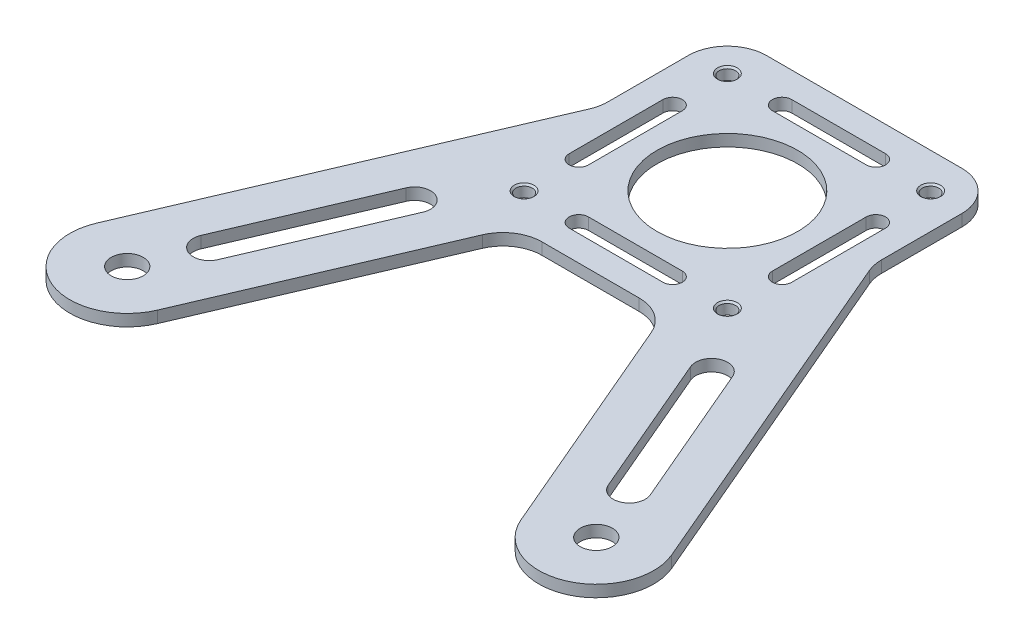
from build123d import *

# Parameters (mm, degrees)
EXTRUDE_1_DEPTH              = 3
HOLE_WIZARD_M5_1_D           = 4.2
HOLE_WIZARD_M5_1_CSINK_D     = 5.05
HOLE_WIZARD_M5_1_CSINK_ANGLE = 90
CUT_EXTRUDE_1_REACH          = 182.424
SKETCH_4_R                   = 4.1
FILLET_1_R                   = 10
CUT_EXTRUDE_2_REACH          = 182.424
SKETCH_5_R                   = 18
CUT_EXTRUDE_3_REACH          = 182.424


with BuildPart() as part:
    # 草图1 → 凸台-拉伸1 (new body)
    with BuildSketch(Plane(origin=(0, 0, 0), x_dir=(1, 0, 0), z_dir=(0, 1, 0))):
        with BuildLine():
            Line((0, 0), (70, 0))
            Line((70, 0), (70, -32.596529214))
            Line((70, -32.596529214), (83.512088558, -64.228012072))
            Line((83.512088558, -64.228012072), (108.512088558, -122.752426568))
            ThreePointArc((108.512088558, -122.752426568), (100.771987928, -142.036503054), (81.487911442, -134.296402424))
            Line((81.487911442, -134.296402424), (56.487911442, -75.771987928))
            Line((56.487911442, -75.771987928), (54.022278946, -70))
            Line((54.022278946, -70), (15.977721054, -70))
            Line((15.977721054, -70), (13.512088558, -75.771987928))
            Line((13.512088558, -75.771987928), (-11.487911442, -134.296402424))
            ThreePointArc((-11.487911442, -134.296402424), (-30.771987928, -142.036503054), (-38.512088558, -122.752426568))
            Line((-38.512088558, -122.752426568), (-13.512088558, -64.228012072))
            Line((-13.512088558, -64.228012072), (0, -32.596529214))
            Line((0, -32.596529214), (0, 0))
        make_face()
    extrude(amount=EXTRUDE_1_DEPTH)

    # M5 螺纹孔1 (through all)
    with Locations(Plane(origin=(0, 3, 0), x_dir=(1, 0, 0), z_dir=(0, 1, 0))):
        with Locations((9, -61), (61, -9), (9, -9), (61, -61)):
            CounterSinkHole(HOLE_WIZARD_M5_1_D / 2, HOLE_WIZARD_M5_1_CSINK_D / 2, counter_sink_angle=HOLE_WIZARD_M5_1_CSINK_ANGLE)

    # 草图4 → 切除-拉伸1 (cut, up to next)
    with BuildSketch(Plane(origin=(0, 3, 0), x_dir=(1, 0, 0), z_dir=(0, 1, 0)), mode=Mode.PRIVATE) as cut_extrude_1_sk1:
        with Locations(Location((-25, -128.524414496, 0), (0, 0, 270))):
            Circle(SKETCH_4_R)
    cut_extrude_1_tool1 = extrude(cut_extrude_1_sk1.sketch, amount=-CUT_EXTRUDE_1_REACH, mode=Mode.PRIVATE) & part.part
    # 草图4 → 切除-拉伸1 (cut, up to next)
    with BuildSketch(Plane(origin=(0, 3, 0), x_dir=(1, 0, 0), z_dir=(0, 1, 0)), mode=Mode.PRIVATE) as cut_extrude_1_sk2:
        with Locations(Location((95, -128.524414496, 0), (0, 0, 270))):
            Circle(SKETCH_4_R)
    cut_extrude_1_tool2 = extrude(cut_extrude_1_sk2.sketch, amount=-CUT_EXTRUDE_1_REACH, mode=Mode.PRIVATE) & part.part
    add(cut_extrude_1_tool1.solids().sort_by_distance((-25, 3, 128.524414))[0], mode=Mode.SUBTRACT)
    add(cut_extrude_1_tool2.solids().sort_by_distance((95, 3, 128.524414))[0], mode=Mode.SUBTRACT)

    # 圆角1
    fillet_1_edges = [part.edges().sort_by_distance(p)[0] for p in [
        (0, 1.5, 0),
        (70, 1.5, 0),
        (70, 1.5, 32.596529214),
        (54.022278946, 1.5, 70),
        (15.977721054, 1.5, 70),
        (0, 1.5, 32.596529214),
    ]]
    fillet(fillet_1_edges, radius=FILLET_1_R)

    # 草图5 → 切除-拉伸2 (cut, up to next)
    with BuildSketch(Plane(origin=(0, 3, 0), x_dir=(1, 0, 0), z_dir=(0, 1, 0)), mode=Mode.PRIVATE) as cut_extrude_2_sk1:
        with Locations(Location((35, -35, 0), (0, 0, 270))):
            Circle(SKETCH_5_R)
    cut_extrude_2_tool1 = extrude(cut_extrude_2_sk1.sketch, amount=-CUT_EXTRUDE_2_REACH, mode=Mode.PRIVATE) & part.part
    add(cut_extrude_2_tool1.solids().sort_by_distance((35, 3, 35))[0], mode=Mode.SUBTRACT)

    # 草图6 → 切除-拉伸3 (cut, up to next)
    with BuildSketch(Plane(origin=(0, 3, 0), x_dir=(1, 0, 0), z_dir=(0, 1, 0)), mode=Mode.PRIVATE) as cut_extrude_3_sk1:
        with BuildLine():
            Line((-22.485091694, -112.200038973), (-6.771815415, -75.415627212))
            ThreePointArc((-6.771815415, -75.415627212), (-1.390802391, -73.255835825), (0.768988996, -78.636848849))
            Line((0.768988996, -78.636848849), (-14.944287283, -115.42126061))
            ThreePointArc((-14.944287283, -115.42126061), (-20.325300307, -117.581051997), (-22.485091694, -112.200038973))
        make_face()
    cut_extrude_3_tool1 = extrude(cut_extrude_3_sk1.sketch, amount=-CUT_EXTRUDE_3_REACH, mode=Mode.PRIVATE) & part.part
    # 草图6 → 切除-拉伸3 (cut, up to next)
    with BuildSketch(Plane(origin=(0, 3, 0), x_dir=(1, 0, 0), z_dir=(0, 1, 0)), mode=Mode.PRIVATE) as cut_extrude_3_sk2:
        with BuildLine():
            Line((92.485091694, -112.200038973), (76.771815415, -75.415627212))
            ThreePointArc((76.771815415, -75.415627212), (71.390802391, -73.255835825), (69.231011004, -78.636848849))
            Line((69.231011004, -78.636848849), (84.944287283, -115.42126061))
            ThreePointArc((84.944287283, -115.42126061), (90.325300307, -117.581051997), (92.485091694, -112.200038973))
        make_face()
    cut_extrude_3_tool2 = extrude(cut_extrude_3_sk2.sketch, amount=-CUT_EXTRUDE_3_REACH, mode=Mode.PRIVATE) & part.part
    # 草图6 → 切除-拉伸3 (cut, up to next)
    with BuildSketch(Plane(origin=(0, 3, 0), x_dir=(1, 0, 0), z_dir=(0, 1, 0)), mode=Mode.PRIVATE) as cut_extrude_3_sk3:
        with BuildLine():
            Line((23, -6.522932736), (47, -6.522932736))
            ThreePointArc((47, -6.522932736), (49.477067264, -9), (47, -11.477067264))
            Line((47, -11.477067264), (23, -11.477067264))
            ThreePointArc((23, -11.477067264), (20.522932736, -9), (23, -6.522932736))
        make_face()
    cut_extrude_3_tool3 = extrude(cut_extrude_3_sk3.sketch, amount=-CUT_EXTRUDE_3_REACH, mode=Mode.PRIVATE) & part.part
    # 草图6 → 切除-拉伸3 (cut, up to next)
    with BuildSketch(Plane(origin=(0, 3, 0), x_dir=(1, 0, 0), z_dir=(0, 1, 0)), mode=Mode.PRIVATE) as cut_extrude_3_sk4:
        with BuildLine():
            Line((63.477067264, -23), (63.477067264, -47))
            ThreePointArc((63.477067264, -47), (61, -49.477067264), (58.522932736, -47))
            Line((58.522932736, -47), (58.522932736, -23))
            ThreePointArc((58.522932736, -23), (61, -20.522932736), (63.477067264, -23))
        make_face()
    cut_extrude_3_tool4 = extrude(cut_extrude_3_sk4.sketch, amount=-CUT_EXTRUDE_3_REACH, mode=Mode.PRIVATE) & part.part
    # 草图6 → 切除-拉伸3 (cut, up to next)
    with BuildSketch(Plane(origin=(0, 3, 0), x_dir=(1, 0, 0), z_dir=(0, 1, 0)), mode=Mode.PRIVATE) as cut_extrude_3_sk5:
        with BuildLine():
            Line((47, -63.477067264), (23, -63.477067264))
            ThreePointArc((23, -63.477067264), (20.522932736, -61), (23, -58.522932736))
            Line((23, -58.522932736), (47, -58.522932736))
            ThreePointArc((47, -58.522932736), (49.477067264, -61), (47, -63.477067264))
        make_face()
    cut_extrude_3_tool5 = extrude(cut_extrude_3_sk5.sketch, amount=-CUT_EXTRUDE_3_REACH, mode=Mode.PRIVATE) & part.part
    # 草图6 → 切除-拉伸3 (cut, up to next)
    with BuildSketch(Plane(origin=(0, 3, 0), x_dir=(1, 0, 0), z_dir=(0, 1, 0)), mode=Mode.PRIVATE) as cut_extrude_3_sk6:
        with BuildLine():
            Line((6.522932736, -47), (6.522932736, -23))
            ThreePointArc((6.522932736, -23), (9, -20.522932736), (11.477067264, -23))
            Line((11.477067264, -23), (11.477067264, -47))
            ThreePointArc((11.477067264, -47), (9, -49.477067264), (6.522932736, -47))
        make_face()
    cut_extrude_3_tool6 = extrude(cut_extrude_3_sk6.sketch, amount=-CUT_EXTRUDE_3_REACH, mode=Mode.PRIVATE) & part.part
    add(cut_extrude_3_tool1.solids().sort_by_distance((-10.858051, 3, 95.418444))[0], mode=Mode.SUBTRACT)
    add(cut_extrude_3_tool2.solids().sort_by_distance((80.858051, 3, 95.418444))[0], mode=Mode.SUBTRACT)
    add(cut_extrude_3_tool3.solids().sort_by_distance((35, 3, 9))[0], mode=Mode.SUBTRACT)
    add(cut_extrude_3_tool4.solids().sort_by_distance((61, 3, 35))[0], mode=Mode.SUBTRACT)
    add(cut_extrude_3_tool5.solids().sort_by_distance((35, 3, 61))[0], mode=Mode.SUBTRACT)
    add(cut_extrude_3_tool6.solids().sort_by_distance((9, 3, 35))[0], mode=Mode.SUBTRACT)


solid = part.part
